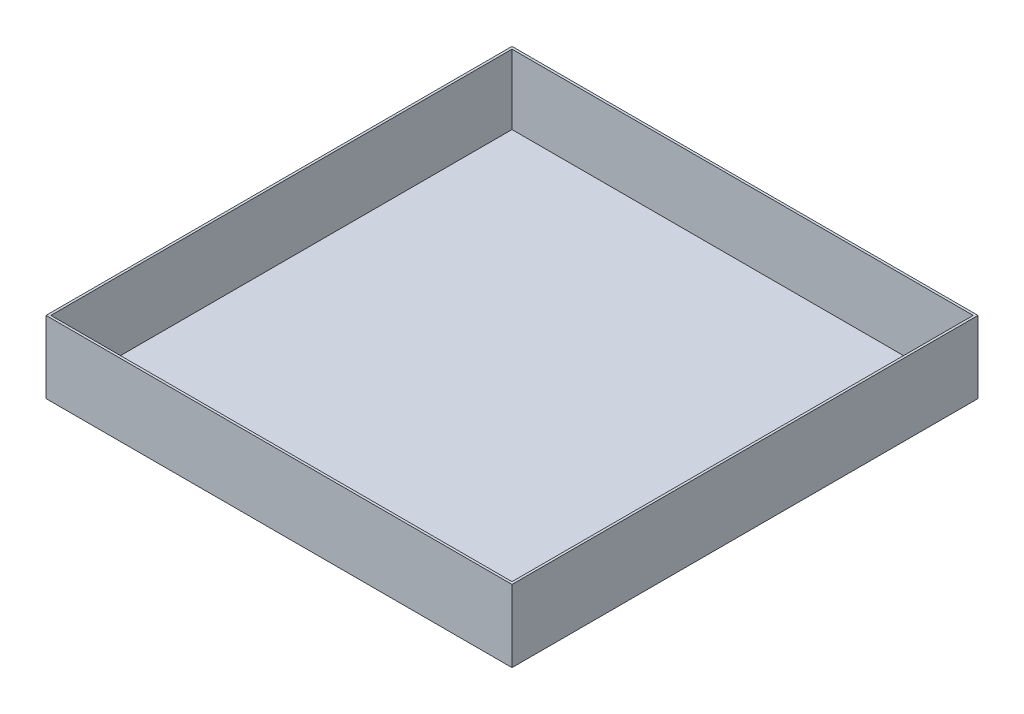
from build123d import *

# Parameters (mm, degrees)
SKETCH_1_W      = 194
SKETCH_1_H      = 194
EXTRUDE_1_DEPTH = 30
SHELL_1_T       = -1


with BuildPart() as part:
    # 草图1 → 凸台-拉伸1 (new body)
    with BuildSketch(Plane(origin=(0, 0, 0), x_dir=(1, 0, 0), z_dir=(0, 1, 0))):
        with Locations((97, 97)):
            Rectangle(SKETCH_1_W, SKETCH_1_H)
    extrude(amount=EXTRUDE_1_DEPTH)

    # 抽壳1
    shell_1_openings = [part.faces().sort_by_distance(p)[0] for p in [
        (97, 30, -97),
    ]]
    offset(amount=SHELL_1_T, openings=shell_1_openings, kind=Kind.INTERSECTION)


solid = part.part
